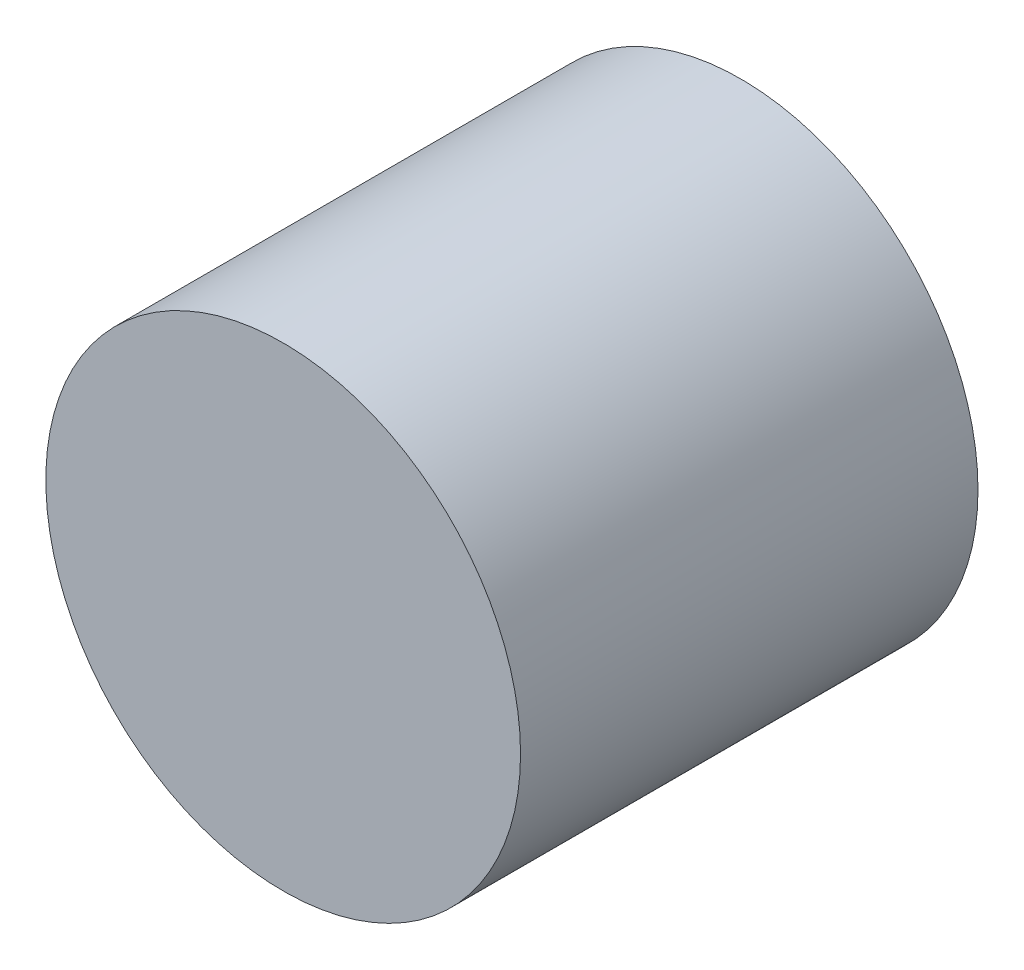
from build123d import *

# Parameters (mm, degrees)
SKETCH1_R           = 13.75
BOSS_EXTRUDE1_DEPTH = 26.5


with BuildPart() as part:
    # Sketch1 → Boss-Extrude1 (new body)
    with BuildSketch(Plane.XY):
        Circle(SKETCH1_R)
    extrude(amount=-BOSS_EXTRUDE1_DEPTH)


solid = part.part
